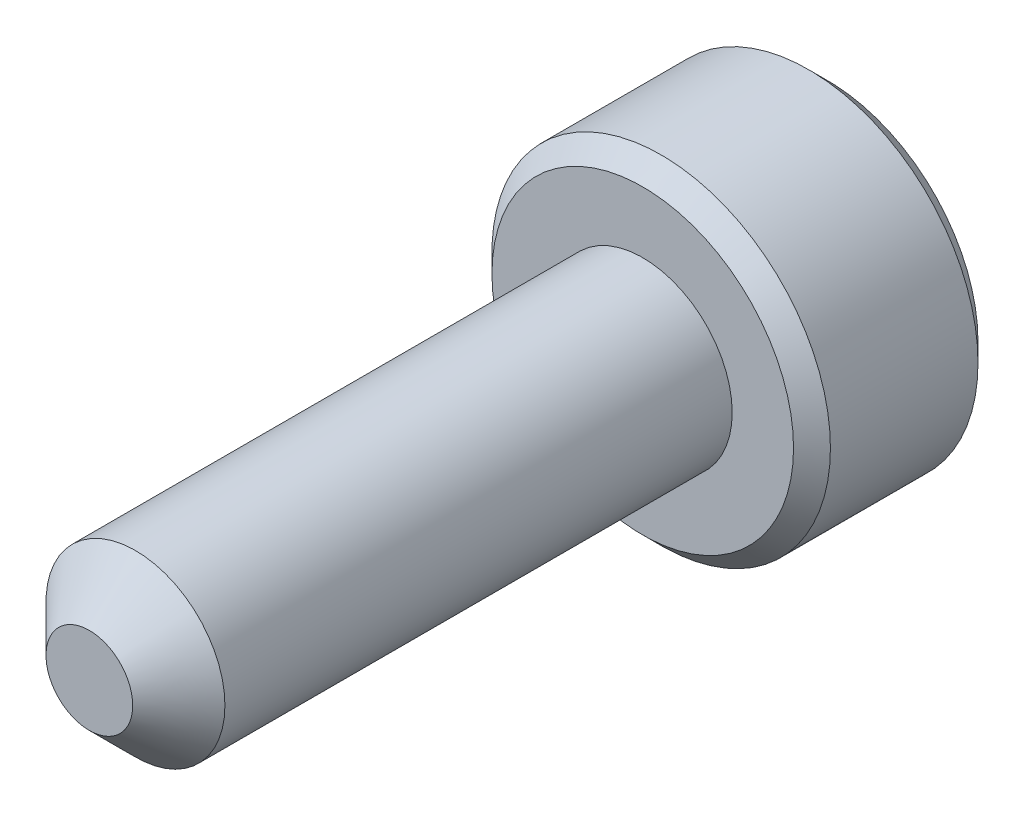
from build123d import *

# Parameters (mm, degrees)
SKETCH3_R           = 1.835
BOSS_EXTRUDE1_DEPTH = 2
SKETCH4_R           = 0.97
BOSS_EXTRUDE2_DEPTH = 6
CHAMFER1_SIZE       = 0.5
CUT_EXTRUDE1_DEPTH  = 1
CHAMFER2_SIZE       = 0.2


with BuildPart() as part:
    # Sketch3 → Boss-Extrude1 (new body)
    with BuildSketch(Plane.XY):
        Circle(SKETCH3_R)
    extrude(amount=BOSS_EXTRUDE1_DEPTH)

    # Sketch4 → Boss-Extrude2 (add)
    with BuildSketch(Plane.XY.offset(2)):
        Circle(SKETCH4_R)
    extrude(amount=BOSS_EXTRUDE2_DEPTH)

    # Chamfer1
    chamfer1_edges = [part.edges().sort_by_distance(p)[0] for p in [
        (-0.97, 0, 8),
    ]]
    chamfer(chamfer1_edges, length=CHAMFER1_SIZE)

    # Sketch5 → Cut-Extrude1 (cut)
    with BuildSketch(Plane(origin=(0, 0, 0), x_dir=(-1, 0, 0), z_dir=(0, 0, -1))):
        Polygon((1.145251225, 0), (0.572625613, 0.991816655), (-0.572625613, 0.991816655), (-1.145251225, 0), (-0.572625613, -0.991816655), (0.572625613, -0.991816655), align=None)
    extrude(amount=-CUT_EXTRUDE1_DEPTH, mode=Mode.SUBTRACT)

    # Chamfer2
    chamfer2_edges = [part.edges().sort_by_distance(p)[0] for p in [
        (-1.835, 0, 0),
        (-1.835, 0, 2),
    ]]
    chamfer(chamfer2_edges, length=CHAMFER2_SIZE)


solid = part.part
